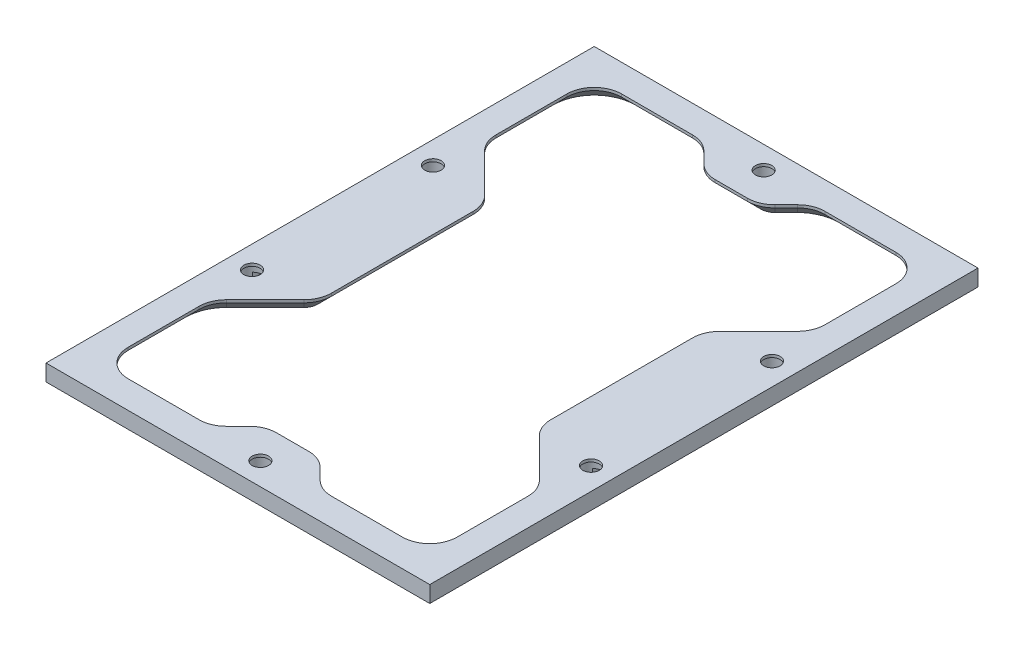
from build123d import *

# Parameters (mm, degrees)
SKETCH1_W           = 140
SKETCH1_H           = 200
BOSS_EXTRUDE1_DEPTH = 6
FILLET1_R           = 10
FILLET2_R           = 10
CHAMFER4_SIZE       = 5
CUT_EXTRUDE1_DEPTH  = 2
SKETCH7_R           = 3
CUT_EXTRUDE3_DEPTH  = 10
SKETCH8_R           = 4.5
CUT_EXTRUDE4_DEPTH  = 5


with BuildPart() as part:
    # Sketch1 → Boss-Extrude1 (new body)
    with BuildSketch(Plane(origin=(0, 0, 0), x_dir=(1, 0, 0), z_dir=(0, 1, 0))):
        with Locations((70, 100)):
            Rectangle(SKETCH1_W, SKETCH1_H)
        Polygon((10, 190), (50, 190), (60, 180), (80, 180), (90, 190), (130, 190), (130, 150), (110, 130), (110, 70), (130, 50), (130, 10), (90, 10), (80, 20), (60, 20), (50, 10), (10, 10), (10, 50), (30, 70), (30, 130), (10, 150), align=None, mode=Mode.SUBTRACT)
    extrude(amount=BOSS_EXTRUDE1_DEPTH)

    # Fillet1
    fillet1_edges = [part.edges().sort_by_distance(p)[0] for p in [
        (10, 3, -190),
    ]]
    fillet(fillet1_edges, radius=FILLET1_R)

    # Fillet2
    fillet2_edges = [part.edges().sort_by_distance(p)[0] for p in [
        (10, 3, -150),
        (30, 3, -130),
        (30, 3, -70),
        (10, 3, -50),
        (10, 3, -10),
        (50, 3, -10),
        (60, 3, -20),
        (80, 3, -20),
        (90, 3, -10),
        (130, 3, -10),
        (130, 3, -50),
        (110, 3, -70),
        (110, 3, -130),
        (130, 3, -150),
        (130, 3, -190),
        (90, 3, -190),
        (80, 3, -180),
        (60, 3, -180),
        (50, 3, -190),
    ]]
    fillet(fillet2_edges, radius=FILLET2_R)

    # Chamfer4
    chamfer4_edges = [part.edges().sort_by_distance(p)[0] for p in [
        (79.6846987, 0, -19.238795325),
        (60.3153013, 0, -19.238795325),
        (29.238795325, 0, -70.3153013),
        (29.238795325, 0, -129.6846987),
        (10.761204675, 0, -150.3153013),
        (10.761204675, 0, -49.6846987),
        (12.928932188, 0, -12.928932188),
        (49.6846987, 0, -10.761204675),
        (90.3153013, 0, -10.761204675),
        (127.071067812, 0, -12.928932188),
        (129.238795325, 0, -49.6846987),
        (129.238795325, 0, -150.3153013),
        (127.071067812, 0, -187.071067812),
        (90.3153013, 0, -189.238795325),
        (49.6846987, 0, -189.238795325),
        (10, 0, -167.071067812),
        (12.928932188, 0, -187.071067812),
        (20, 0, -140),
        (32.928932188, 0, -190),
        (30, 0, -100),
        (20, 0, -60),
        (10, 0, -32.928932188),
        (32.928932188, 0, -10),
        (55, 0, -15),
        (70, 0, -20),
        (85, 0, -15),
        (107.071067812, 0, -10),
        (130, 0, -32.928932188),
        (120, 0, -60),
        (110, 0, -100),
        (120, 0, -140),
        (130, 0, -167.071067812),
        (107.071067812, 0, -190),
        (85, 0, -185),
        (70, 0, -180),
        (55, 0, -185),
        (60.3153013, 0, -180.761204675),
        (79.6846987, 0, -180.761204675),
        (110.761204675, 0, -129.6846987),
        (110.761204675, 0, -70.3153013),
    ]]
    chamfer(chamfer4_edges, length=CHAMFER4_SIZE)

    # Sketch6 → Cut-Extrude1 (cut)
    with BuildSketch(Plane.XZ):
        with BuildLine():
            Line((118, -125), (118, -75))
            ThreePointArc((118, -75), (121, -72), (124, -75))
            Line((124, -75), (124, -125))
            ThreePointArc((124, -125), (121, -128), (118, -125))
        make_face()
        with BuildLine():
            Line((129, -133.028561836), (129, -67.028561836))
            ThreePointArc((129, -67.028561836), (132, -64.028561836), (135, -67.028561836))
            Line((135, -67.028561836), (135, -133.028561836))
            ThreePointArc((135, -133.028561836), (132, -136.028561836), (129, -133.028561836))
        make_face()
        with BuildLine():
            Line((22, -125), (22, -75))
            ThreePointArc((22, -75), (19, -72), (16, -75))
            Line((16, -75), (16, -125))
            ThreePointArc((16, -125), (19, -128), (22, -125))
        make_face()
        with BuildLine():
            Line((11, -133.028561836), (11, -67.028561836))
            ThreePointArc((11, -67.028561836), (8, -64.028561836), (5, -67.028561836))
            Line((5, -67.028561836), (5, -133.028561836))
            ThreePointArc((5, -133.028561836), (8, -136.028561836), (11, -133.028561836))
        make_face()
    extrude(amount=-CUT_EXTRUDE1_DEPTH, mode=Mode.SUBTRACT)

    # Sketch7 → Cut-Extrude3 (cut)
    with BuildSketch(Plane(origin=(0, 6, 0), x_dir=(1, 0, 0), z_dir=(0, 1, 0))):
        with Locations(Location((70, 191.8, 0), (0, 0, 270))):
            Circle(SKETCH7_R)
        with Locations(Location((8.166074554, 133, 0), (0, 0, 270))):
            Circle(SKETCH7_R)
        with Locations(Location((70, 8.2, 0), (0, 0, 90))):
            Circle(SKETCH7_R)
        with Locations(Location((8.166074554, 67, 0), (0, 0, 258.632230209))):
            Circle(SKETCH7_R)
        with Locations(Location((131.833925446, 67, 0), (0, 0, 270))):
            Circle(SKETCH7_R)
        with Locations(Location((131.833925446, 133, 0), (0, 0, 199.153699919))):
            Circle(SKETCH7_R)
    extrude(amount=-CUT_EXTRUDE3_DEPTH, mode=Mode.SUBTRACT)

    # Sketch8 → Cut-Extrude4 (cut)
    with BuildSketch(Plane.XZ):
        with Locations(Location((70, -8.2, 0), (0, 0, 270))):
            Circle(SKETCH8_R)
        with Locations(Location((8, -67.028561836, 0), (0, 0, 270))):
            Circle(SKETCH8_R)
        with Locations(Location((132, -67.028561836, 0), (0, 0, 228.189685104))):
            Circle(SKETCH8_R)
        with Locations(Location((8, -132.971438164, 0), (0, 0, 131.810314896))):
            Circle(SKETCH8_R)
        with Locations(Location((70, -191.8, 0), (0, 0, 90))):
            Circle(SKETCH8_R)
        with Locations(Location((132, -132.971438164, 0), (0, 0, 270))):
            Circle(SKETCH8_R)
    extrude(amount=-CUT_EXTRUDE4_DEPTH, mode=Mode.SUBTRACT)


solid = part.part
